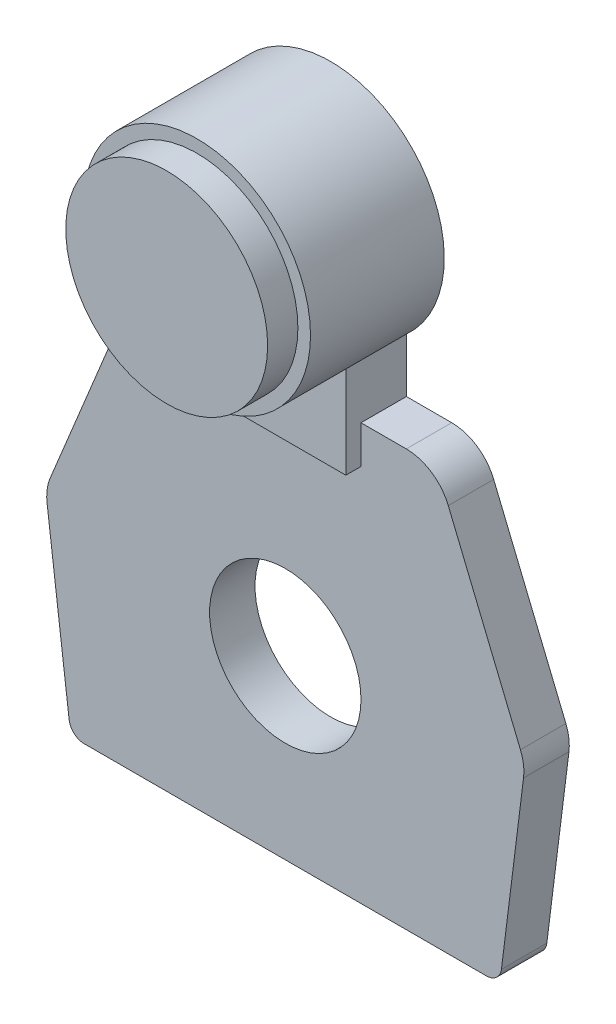
from build123d import *

# Parameters (mm, degrees)
COVER_START          = 72
COVER_DEPTH          = 18
PUMP_START           = 72
SKETCH2_W            = 60
SKETCH2_H            = 70
PUMP_WEB_DEPTH       = 24
WATER_START          = 72
SKETCH3_R            = 45
WATER_PUMP_DEPTH     = 53
PUMP_START_2         = 125
SKETCH4_R            = 40
PUMP_PULLEY_DEPTH    = 12
SEAL_BORE_DEPTH      = 257.38624879
SEAL_BORE_DEPTH_BACK = 257.38624879
SKETCH5_R            = 30


with BuildPart() as part:
    # Sketch1 → Cover (new body)
    with BuildSketch(Plane.XY.offset(COVER_START)):
        with BuildLine():
            Line((-79.703306689, -70), (79.703306689, -70))
            ThreePointArc((79.703306689, -70), (83.674122068, -68.498069055), (85.656973949, -64.744208408))
            Line((85.656973949, -64.744208408), (94.412091509, 5.296732068))
            ThreePointArc((94.412091509, 5.296732068), (94.391822309, 9.918554009), (93.1952955, 14.382853785))
            Line((93.1952955, 14.382853785), (64.589736738, 83.853496495))
            ThreePointArc((64.589736738, 83.853496495), (57.96144488, 91.955984369), (47.945530965, 95))
            Line((47.945530965, 95), (-47.945530965, 95))
            ThreePointArc((-47.945530965, 95), (-57.96144488, 91.955984369), (-64.589736738, 83.853496495))
            Line((-64.589736738, 83.853496495), (-93.1952955, 14.382853785))
            ThreePointArc((-93.1952955, 14.382853785), (-94.391822309, 9.918554009), (-94.412091509, 5.296732068))
            Line((-94.412091509, 5.296732068), (-85.656973949, -64.744208408))
            ThreePointArc((-85.656973949, -64.744208408), (-83.674122068, -68.498069055), (-79.703306689, -70))
        make_face()
    extrude(amount=COVER_DEPTH)

    # Sketch2 → Pump Web (add)
    with BuildSketch(Plane.XY.offset(PUMP_START)):
        with Locations((0, 115)):
            Rectangle(SKETCH2_W, SKETCH2_H)
    extrude(amount=PUMP_WEB_DEPTH)

    # Sketch3 → Water Pump (add)
    with BuildSketch(Plane.XY.offset(WATER_START)):
        with Locations(Location((0, 150, 0), (0, 0, 228.189685104))):
            Circle(SKETCH3_R)
    extrude(amount=WATER_PUMP_DEPTH)

    # Sketch4 → Pump Pulley (add)
    with BuildSketch(Plane.XY.offset(PUMP_START_2)):
        with Locations((0, 150)):
            Circle(SKETCH4_R)
    extrude(amount=PUMP_PULLEY_DEPTH)

    # Sketch5 → Seal Bore (cut, two sides: drawn at the far end of the back side and taken through both)
    with BuildSketch(Plane.XY.offset(-SEAL_BORE_DEPTH_BACK)):
        Circle(SKETCH5_R)
    extrude(amount=SEAL_BORE_DEPTH + SEAL_BORE_DEPTH_BACK, mode=Mode.SUBTRACT)


solid = part.part
